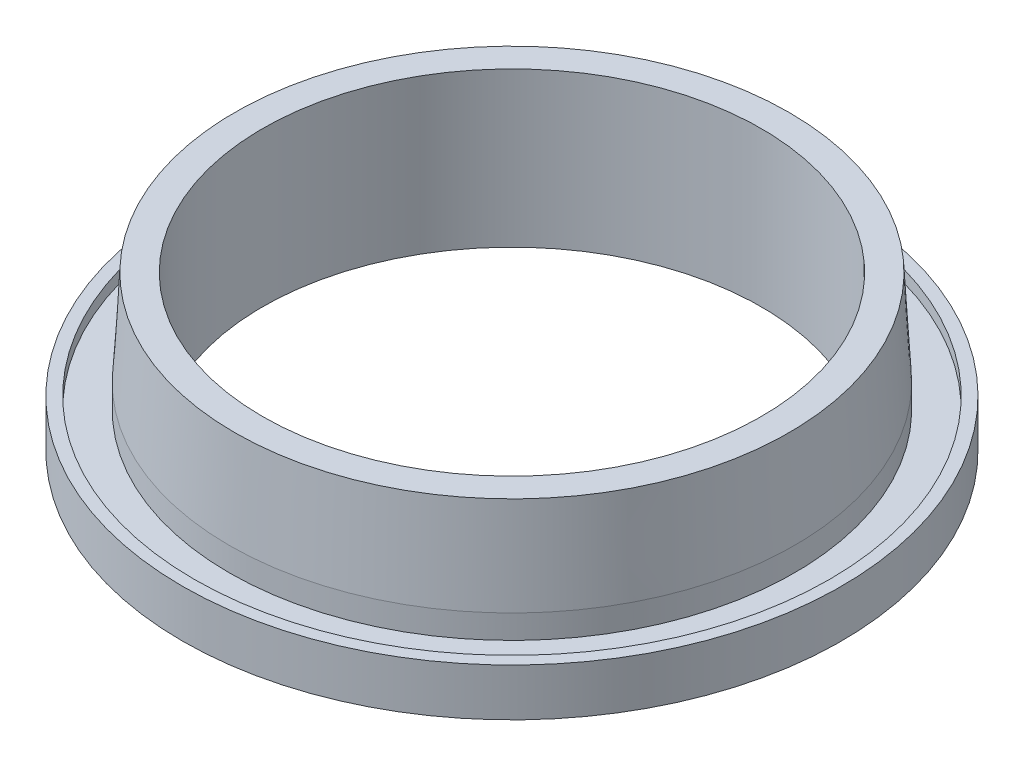
from build123d import *

# Parameters (mm, degrees)
SKETCH1_R               = 69.375
SKETCH1_R_2             = 66.875
BOSS_EXTRUDE1_DEPTH     = 2.5
BOSS_EXTRUDE2_START     = -7.5
SKETCH2_R               = 69.375
BOSS_EXTRUDE2_DEPTH     = 7.5
SKETCH3_R               = 59.5
BOSS_EXTRUDE3_DEPTH     = 25
CHAMFER1_SIZE           = 20
CHAMFER1_SIZE2          = 1.135682303
CUT_EXTRUDE1_DEPTH      = 104.353912601
CUT_EXTRUDE1_DEPTH_BACK = 104.353912601
SKETCH4_R               = 52.5


with BuildPart() as part:
    # Sketch1 → Boss-Extrude1 (new body)
    with BuildSketch(Plane(origin=(0, 0, 0), x_dir=(1, 0, 0), z_dir=(0, 1, 0))):
        with Locations(Location((0, 0, 0), (0, 0, 270))):
            Circle(SKETCH1_R)
        with Locations(Location((0, 0, 0), (0, 0, 270))):
            Circle(SKETCH1_R_2, mode=Mode.SUBTRACT)
    extrude(amount=BOSS_EXTRUDE1_DEPTH)

    # Sketch2 → Boss-Extrude2 (add)
    with BuildSketch(Plane(origin=(0, 0, 0), x_dir=(1, 0, 0), z_dir=(0, 1, 0)).offset(BOSS_EXTRUDE2_START)):
        with Locations(Location((0, 0, 0), (0, 0, 270))):
            Circle(SKETCH2_R)
    extrude(amount=BOSS_EXTRUDE2_DEPTH)

    # Sketch3 → Boss-Extrude3 (add)
    with BuildSketch(Plane(origin=(0, 0, 0), x_dir=(1, 0, 0), z_dir=(0, 1, 0))):
        with Locations(Location((0, 0, 0), (0, 0, 270))):
            Circle(SKETCH3_R)
    extrude(amount=BOSS_EXTRUDE3_DEPTH)

    # Chamfer1
    chamfer1_edges = [part.edges().sort_by_distance(p)[0] for p in [
        (0, 25, -59.5),
    ]]
    chamfer1_side = [part.faces().sort_by_distance(p)[0] for p in [
        (0, 12.5, -59.5),
    ]]
    chamfer(chamfer1_edges, length=CHAMFER1_SIZE, length2=CHAMFER1_SIZE2, reference=chamfer1_side[0])

    # Sketch4 → Cut-Extrude1 (cut, two sides: drawn at the far end of the back side and taken through both)
    with BuildSketch(Plane(origin=(0, 25, 0), x_dir=(1, 0, 0), z_dir=(0, 1, 0)).offset(-CUT_EXTRUDE1_DEPTH_BACK)):
        with Locations(Location((0, 0, 0), (0, 0, 270))):
            Circle(SKETCH4_R)
    extrude(amount=CUT_EXTRUDE1_DEPTH + CUT_EXTRUDE1_DEPTH_BACK, mode=Mode.SUBTRACT)


solid = part.part
